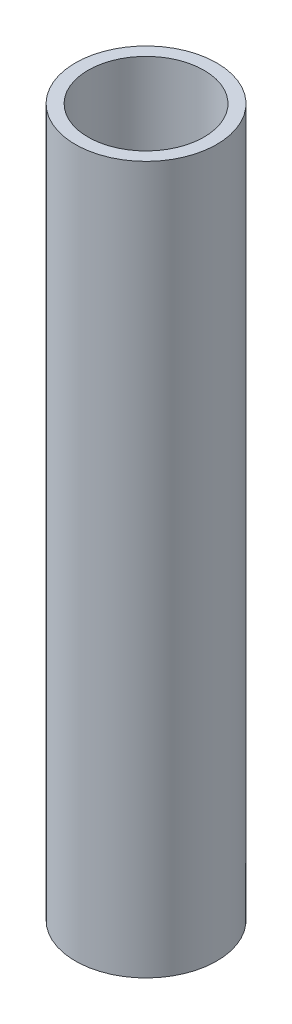
from build123d import *

# Parameters (mm, degrees)
SKETCH1_W = 2.286
SKETCH1_H = 127


with BuildPart() as part:
    # Sketch1 → Revolve1 (revolve)
    with BuildSketch(Plane.XY, mode=Mode.PRIVATE) as revolve1_sk:
        with Locations((11.55319, 63.5)):
            Rectangle(SKETCH1_W, SKETCH1_H)
    revolve(revolve1_sk.sketch.rotate(Axis((0, 127, 0), (0, -1, 0)), 270), axis=Axis((0, 127, 0), (0, -1, 0)))


solid = part.part
